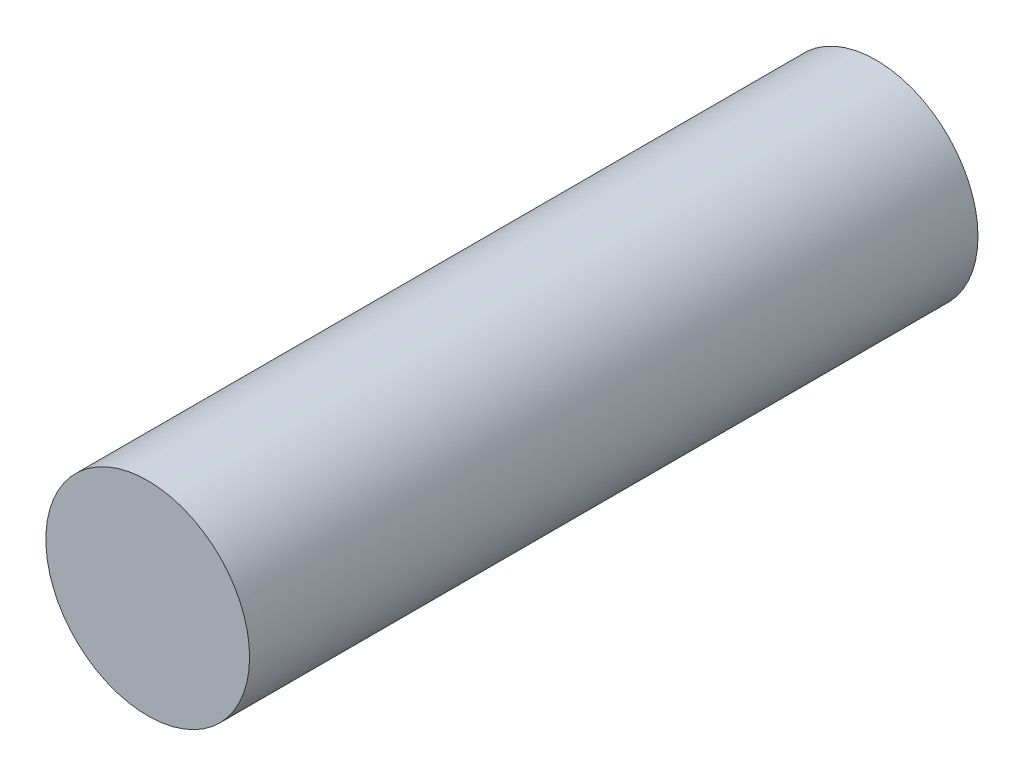
from build123d import *

# Parameters (mm, degrees)
SKETCH_1_R      = 2
EXTRUDE_1_DEPTH = 14.3


with BuildPart() as part:
    # 草图1 → 凸台-拉伸1 (new body)
    with BuildSketch(Plane.XY):
        Circle(SKETCH_1_R)
    extrude(amount=EXTRUDE_1_DEPTH)


solid = part.part
